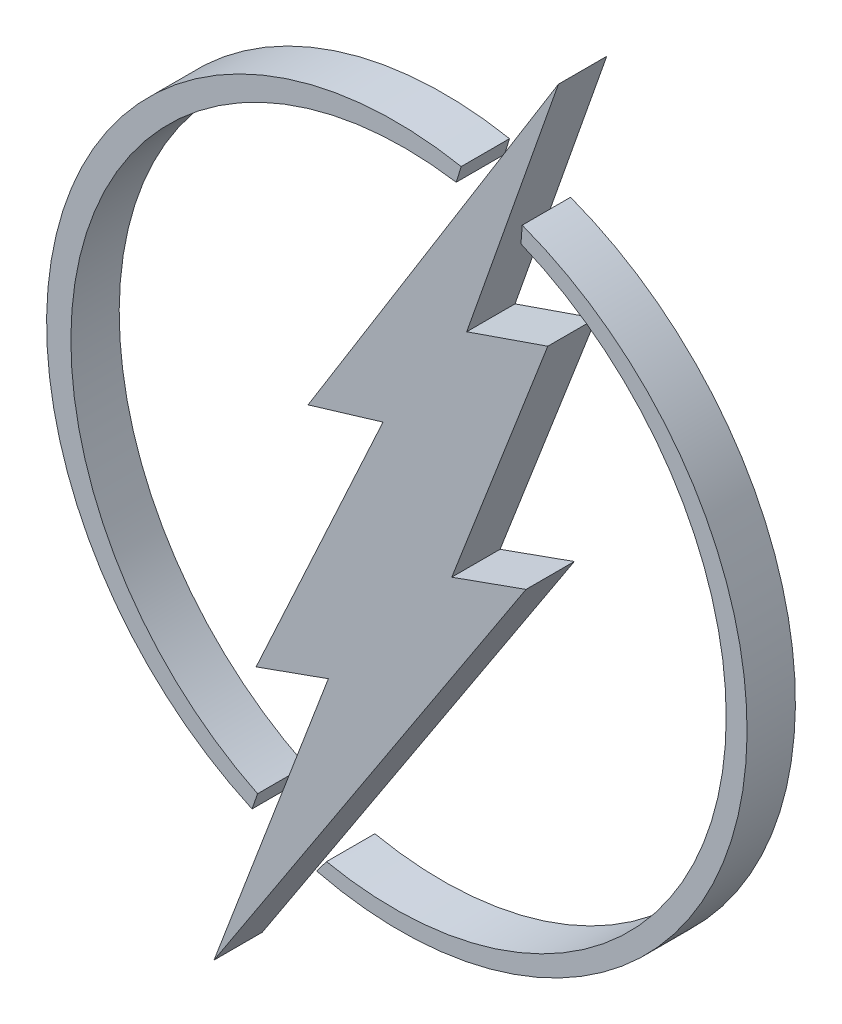
from build123d import *

# Parameters (mm, degrees)
ESQUISSE1_W             = 10
ESQUISSE1_H             = 10
BOSS_EXTRU_1_DEPTH      = 1
BOSS_EXTRU_2_DEPTH      = 0.4
ESQUISSE3_W             = 12.280375392
ESQUISSE3_H             = 11.683913343
ENL_V_MAT_EXTRU_1_DEPTH = 1


with BuildPart() as part:
    # Esquisse1 → Boss.-Extru.1 (new body)
    with BuildSketch(Plane.XY):
        with Locations((5, 5)):
            Rectangle(ESQUISSE1_W, ESQUISSE1_H)
    extrude(amount=BOSS_EXTRU_1_DEPTH)

    # Esquisse2 → Boss.-Extru.2 (add)
    with BuildSketch(Plane.XY.offset(1)):
        Polygon((6.334931749, 8.882833414), (4.262184586, 5.547465589), (4.882830202, 5.734118598), (3.832245005, 3.454123577), (4.430340597, 3.668155532), (3.483509575, 1.17741408), (6.066659864, 5.126849848), (5.451682271, 4.906776572), (6.246715415, 6.960231429), (5.57547524, 6.728124462), align=None)
        with BuildLine():
            Line((5.530169771, 7.890023865), (5.488504184, 7.756335693))
            ThreePointArc((5.488504184, 7.756335693), (2.426904745, 5.860871802), (3.844411762, 2.55075876))
            Line((3.844411762, 2.55075876), (3.798492134, 2.418568254))
            ThreePointArc((3.798492134, 2.418568254), (2.232404609, 5.923983829), (5.530169771, 7.890023865))
        make_face()
        with BuildLine():
            Line((6.024442183, 7.582942033), (6.035237751, 7.722350143))
            ThreePointArc((6.035237751, 7.722350143), (7.767144688, 4.179700726), (4.333254025, 2.241077131))
            Line((4.333254025, 2.241077131), (4.415141932, 2.349442444))
            ThreePointArc((4.415141932, 2.349442444), (7.602289895, 4.23357455), (6.024442183, 7.582942033))
        make_face()
    extrude(amount=BOSS_EXTRU_2_DEPTH)

    # Esquisse3 → Enlèv. mat.-Extru.1 (cut)
    with BuildSketch(Plane(origin=(0, 0, 0), x_dir=(-1, 0, 0), z_dir=(0, 0, -1))):
        with Locations((-4.624490523, 5.133758282)):
            Rectangle(ESQUISSE3_W, ESQUISSE3_H)
    extrude(amount=-ENL_V_MAT_EXTRU_1_DEPTH, mode=Mode.SUBTRACT)


with BuildPart() as enl_v_mat_extru_1_piece_1:
    # of the separate pieces the step leaves, piece 1, a body of its own (enl_v_mat_extru_1_pieces)
    add(part.part.solids().sort_by_distance((6.334931749, 8.882833414, 1))[0])


with BuildPart() as enl_v_mat_extru_1_piece_2:
    # of the separate pieces the step leaves, piece 2, a body of its own (enl_v_mat_extru_1_pieces)
    add(part.part.solids().sort_by_distance((3.798492134, 2.418568254, 1))[0])


with BuildPart() as enl_v_mat_extru_1_piece_3:
    # of the separate pieces the step leaves, piece 3, a body of its own (enl_v_mat_extru_1_pieces)
    add(part.part.solids().sort_by_distance((6.035237751, 7.722350143, 1))[0])


solid = Compound([enl_v_mat_extru_1_piece_1.part, enl_v_mat_extru_1_piece_2.part, enl_v_mat_extru_1_piece_3.part])
